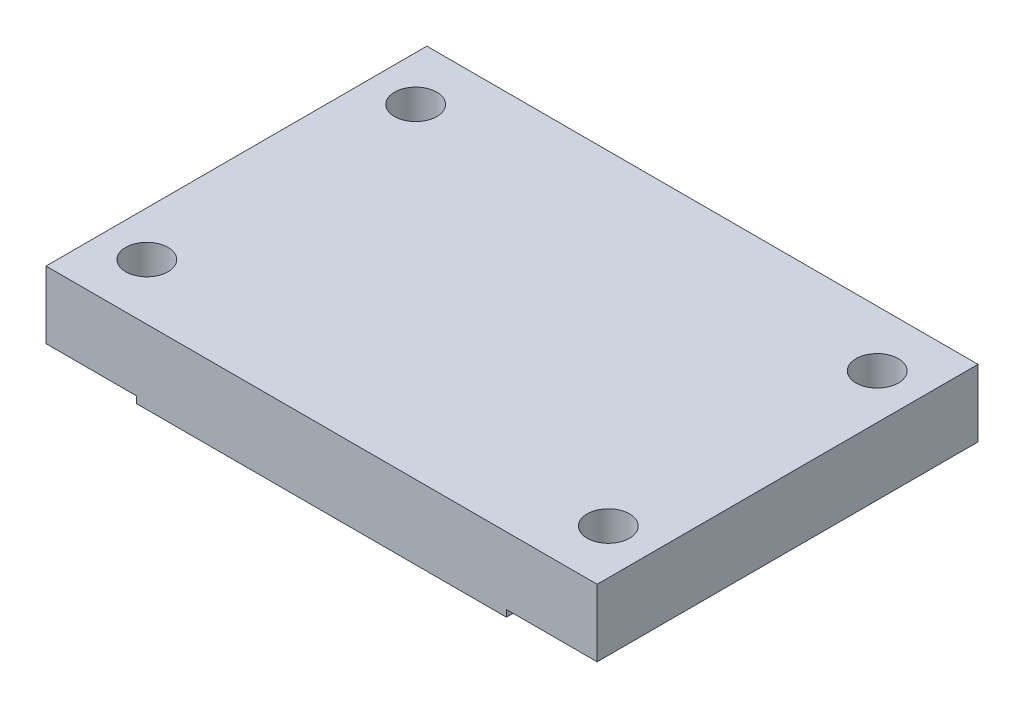
from build123d import *

# Parameters (mm, degrees)
SKETCH1_W           = 62.484
SKETCH1_H           = 43.18
SKETCH1_R           = 2.4003
BOSS_EXTRUDE1_DEPTH = 7.62
SKETCH2_W           = 41.91
SKETCH2_H           = 43.007401248
BOSS_EXTRUDE2_DEPTH = 0.762


with BuildPart() as part:
    # Sketch1 → Boss-Extrude1 (new body)
    with BuildSketch(Plane(origin=(0, 0, 0), x_dir=(1, 0, 0), z_dir=(0, 1, 0))):
        with Locations((0, 0.086299376)):
            Rectangle(SKETCH1_W, SKETCH1_H)
        with Locations(Location((-26.162, 15.326299376, 0), (0, 0, 90))):
            Circle(SKETCH1_R, mode=Mode.SUBTRACT)
        with Locations(Location((-26.162, -15.153700624, 0), (0, 0, 90))):
            Circle(SKETCH1_R, mode=Mode.SUBTRACT)
        with Locations(Location((26.162, -15.153700624, 0), (0, 0, 90))):
            Circle(SKETCH1_R, mode=Mode.SUBTRACT)
        with Locations(Location((26.162, 15.326299376, 0), (0, 0, 90))):
            Circle(SKETCH1_R, mode=Mode.SUBTRACT)
    extrude(amount=BOSS_EXTRUDE1_DEPTH)

    # Sketch2 → Boss-Extrude2 (add)
    with BuildSketch(Plane.XZ):
        Rectangle(SKETCH2_W, SKETCH2_H)
    extrude(amount=BOSS_EXTRUDE2_DEPTH)


solid = part.part
